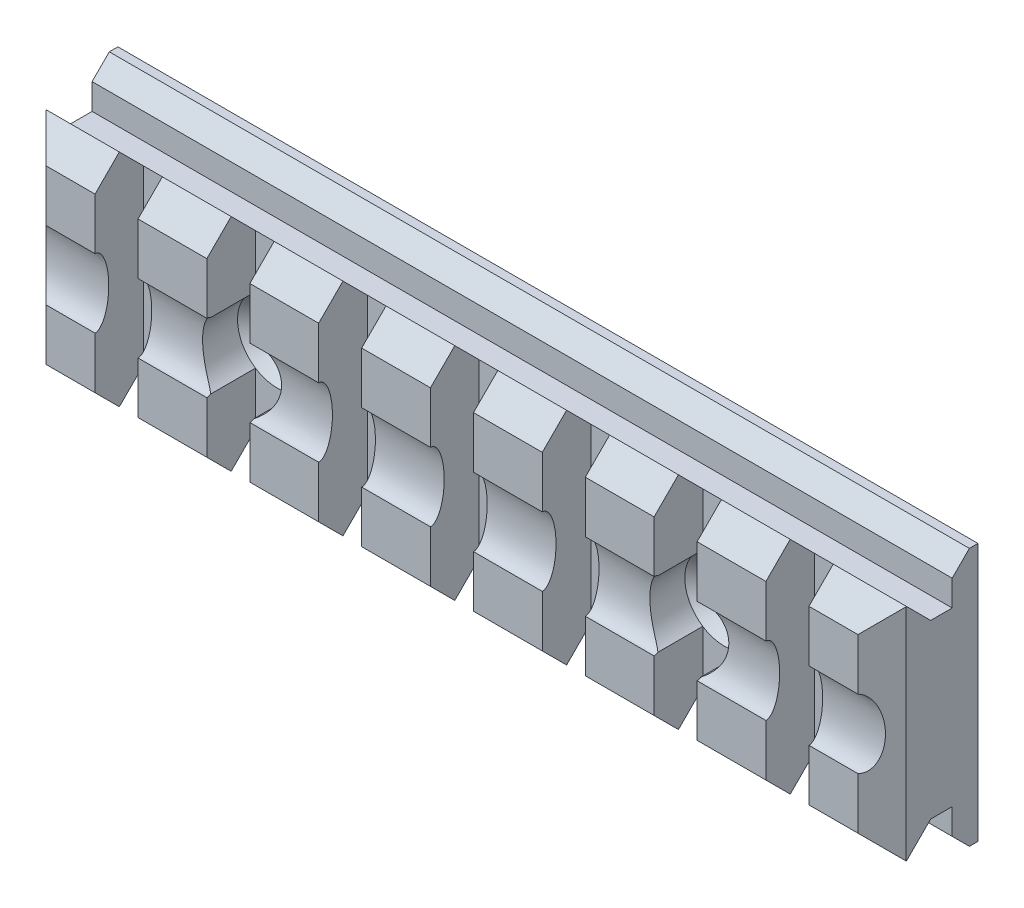
from build123d import *

# Parameters (mm, degrees)
SKIZZE1_W                                   = 100
SKIZZE1_H                                   = 30
AUFSATZ_LINEAR_AUSTRAGEN1_DEPTH             = 3
SKIZZE4_W                                   = 100
SKIZZE4_H                                   = 20
AUFSATZ_LINEAR_AUSTRAGEN2_DEPTH             = 2.5
AUFSATZ_LINEAR_AUSTRAGEN3_DEPTH             = 100
FASE1_SIZE                                  = 2.8
FASE2_SIZE                                  = 2.8
SKIZZE8_W                                   = 5
SKIZZE8_H                                   = 25.656854249
SCHNITT_LINEAR_AUSTRAGEN1_DEPTH             = 5.656854
LINEARES_MUSTER1_COUNT                      = 7
LINEARES_MUSTER1_PITCH                      = 13
FASE3_SIZE                                  = 2
FASE4_SIZE                                  = 2
FORMSENKUNG_F_R_M4_SENKSCHRAUBE_MIT_2_COUNT = 2
FORMSENKUNG_F_R_M4_SENKSCHRAUBE_MIT_2_PITCH = 52
SKIZZE13_RX                                 = 4
SKIZZE13_RY                                 = 1.6
SCHNITT_LINEAR_AUSTRAGEN2_DEPTH             = 103.869332786
SCHNITT_LINEAR_AUSTRAGEN3_REACH             = 67.272
SKIZZE14_R                                  = 4.59


with BuildPart() as part:
    # Skizze1 → Aufsatz-Linear austragen1 (new body)
    with BuildSketch(Plane.XY):
        with Locations((11.40731351, 6.392153494)):
            Rectangle(SKIZZE1_W, SKIZZE1_H)
    extrude(amount=AUFSATZ_LINEAR_AUSTRAGEN1_DEPTH)

    # Skizze4 → Aufsatz-Linear austragen2 (add)
    with BuildSketch(Plane.XY.offset(3)):
        with Locations((11.40731351, 6.392153494)):
            Rectangle(SKIZZE4_W, SKIZZE4_H)
    extrude(amount=AUFSATZ_LINEAR_AUSTRAGEN2_DEPTH)

    # Skizze7 → Aufsatz-Linear austragen3 (add)
    with BuildSketch(Plane(origin=(61.40731351, 0, 0), x_dir=(0, 0, -1), z_dir=(1, 0, 0))):
        Polygon((-5.5, 16.392153494), (-8.328427125, 19.220580618), (-11.156854249, 16.392153494), (-11.156854249, -3.607846506), (-8.328427125, -6.436273631), (-5.5, -3.607846506), align=None)
    extrude(amount=-AUFSATZ_LINEAR_AUSTRAGEN3_DEPTH)

    # Fase1
    fase1_edges = [part.edges().sort_by_distance(p)[0] for p in [
        (61.40731351, 6.392153494, 11.156854249),
    ]]
    chamfer(fase1_edges, length=FASE1_SIZE)

    # Fase2
    fase2_edges = [part.edges().sort_by_distance(p)[0] for p in [
        (-38.59268649, 6.392153494, 11.156854249),
    ]]
    chamfer(fase2_edges, length=FASE2_SIZE)

    # Skizze8 → Schnitt-Linear austragen1 (cut)
    with BuildSketch(Plane.XY.offset(11.156854249)):
        with Locations((-27.59268649, 6.392153493)):
            Rectangle(SKIZZE8_W, SKIZZE8_H)
    schnitt_linear_austragen1 = extrude(amount=-SCHNITT_LINEAR_AUSTRAGEN1_DEPTH, mode=Mode.SUBTRACT)

    # Lineares Muster1: Schnitt-Linear austragen1 ×7
    with Locations(*[(i * LINEARES_MUSTER1_PITCH, 0, 0) for i in range(1, LINEARES_MUSTER1_COUNT)]):
        add(schnitt_linear_austragen1, mode=Mode.SUBTRACT)

    # Fase3
    fase3_edges = [part.edges().sort_by_distance(p)[0] for p in [
        (11.40731351, 21.392153494, 3),
    ]]
    chamfer(fase3_edges, length=FASE3_SIZE)

    # Fase4
    fase4_edges = [part.edges().sort_by_distance(p)[0] for p in [
        (11.40731351, -8.607846506, 3),
    ]]
    chamfer(fase4_edges, length=FASE4_SIZE)

    # Skizze9 → Formsenkung für M4 Senkschraube mit Innensechskant1 (revolve, cut)
    with BuildSketch(Plane(origin=(-14.59268649, 6.392153494, 5.5), x_dir=(0, -1, 0), z_dir=(1, 0, 0))):
        Polygon((0, 0), (0, 5.5), (2.25, 5.5), (2.25, 2.34), (4.59, 0), align=None)
    formsenkung_f_r_m4_senkschraube_mit_inne = revolve(axis=Axis((-14.59268649, 6.392153494, 11.85), (0, 0, -1)), mode=Mode.SUBTRACT)

    # Formsenkung f_r M4 Senkschraube mit  2: Formsenkung für M4 Senkschraube mit Innensechskant1 ×2
    with Locations(*[(i * FORMSENKUNG_F_R_M4_SENKSCHRAUBE_MIT_2_PITCH, 0, 0) for i in range(1, FORMSENKUNG_F_R_M4_SENKSCHRAUBE_MIT_2_COUNT)]):
        add(formsenkung_f_r_m4_senkschraube_mit_inne, mode=Mode.SUBTRACT)

    # Skizze13 → Schnitt-Linear austragen2 (cut, through all)
    with BuildSketch(Plane(origin=(61.40731351, 0, 0), x_dir=(0, 0, -1), z_dir=(1, 0, 0))):
        with Locations(Location((-11.156854249, 6.392153494), (0, 0, 90))):
            Ellipse(SKIZZE13_RX, SKIZZE13_RY)
    extrude(amount=-SCHNITT_LINEAR_AUSTRAGEN2_DEPTH, mode=Mode.SUBTRACT)

    # Schnitt-Linear austragen3: up to this face of the body (flat: up to its plane)
    schnitt_linear_austragen3_end = Plane(part.part.faces().sort_by_distance((-8.09268649, 13.392153494, 11.156854249))[0])
    # Skizze14 → Schnitt-Linear austragen3 (cut, up to the picked face)
    with BuildSketch(Plane.XY.offset(5.5), mode=Mode.PRIVATE) as schnitt_linear_austragen3_sk1:
        with Locations((37.40731351, 6.392153494)):
            Circle(SKIZZE14_R)
    schnitt_linear_austragen3_tool1 = split(extrude(schnitt_linear_austragen3_sk1.sketch, amount=SCHNITT_LINEAR_AUSTRAGEN3_REACH, mode=Mode.PRIVATE), bisect_by=schnitt_linear_austragen3_end, keep=Keep.BOTH, mode=Mode.PRIVATE)
    # Skizze14 → Schnitt-Linear austragen3 (cut, up to the picked face)
    with BuildSketch(Plane.XY.offset(5.5), mode=Mode.PRIVATE) as schnitt_linear_austragen3_sk2:
        with Locations((-14.59268649, 6.392153494)):
            Circle(SKIZZE14_R)
    schnitt_linear_austragen3_tool2 = split(extrude(schnitt_linear_austragen3_sk2.sketch, amount=SCHNITT_LINEAR_AUSTRAGEN3_REACH, mode=Mode.PRIVATE), bisect_by=schnitt_linear_austragen3_end, keep=Keep.BOTH, mode=Mode.PRIVATE)
    add(schnitt_linear_austragen3_tool1.solids().sort_by(Axis((37.407314, 6.392153, 5.5), (0, 0, 1)))[0], mode=Mode.SUBTRACT)
    add(schnitt_linear_austragen3_tool2.solids().sort_by(Axis((-14.592686, 6.392153, 5.5), (0, 0, 1)))[0], mode=Mode.SUBTRACT)


solid = part.part
